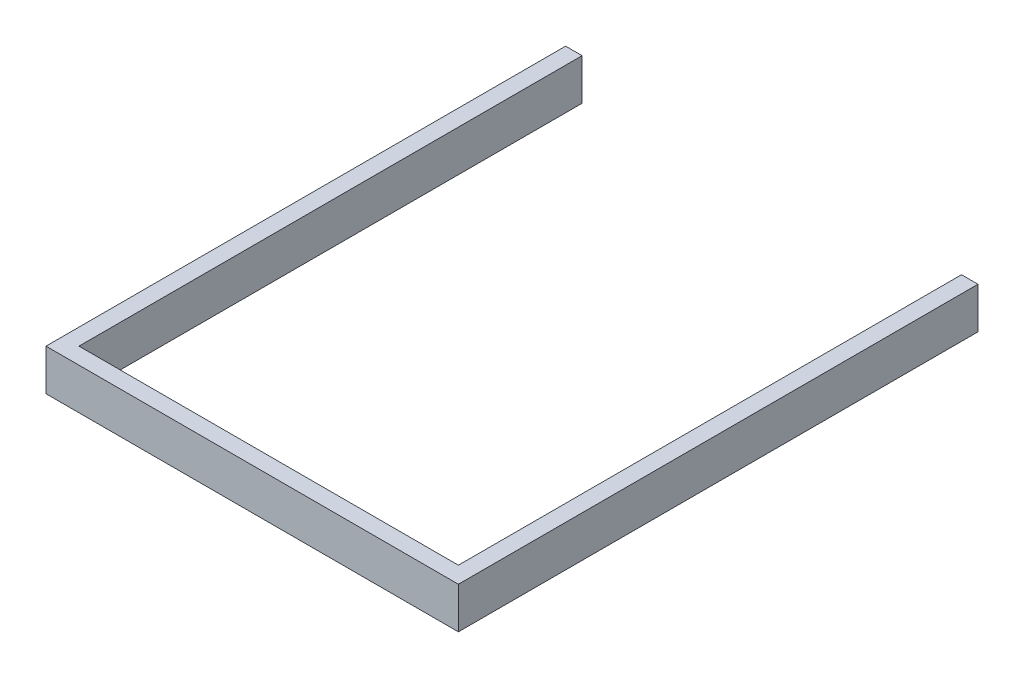
from build123d import *

# Parameters (mm, degrees)
DISPLAY_SUPPORT_DEPTH = 10


with BuildPart() as part:
    # Sketch1 → DISPLAY SUPPORT (new body)
    with BuildSketch(Plane(origin=(0, 0, 0), x_dir=(1, 0, 0), z_dir=(0, 1, 0))):
        Polygon((50, 43), (46, 43), (46, -79), (-46, -79), (-46, 43), (-50, 43), (-50, -83), (50, -83), align=None)
    extrude(amount=-DISPLAY_SUPPORT_DEPTH)


solid = part.part
